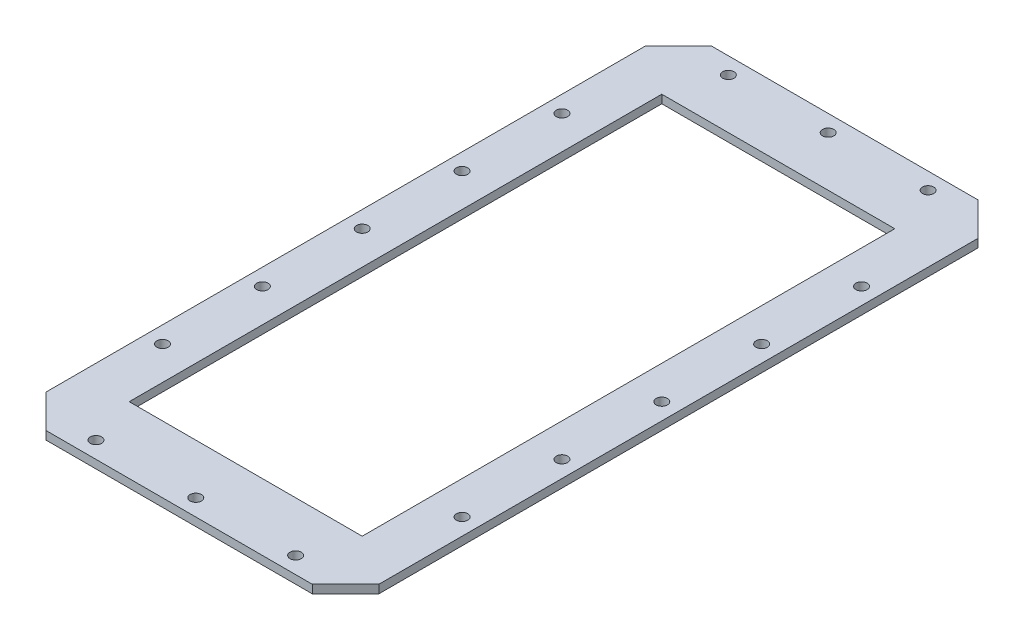
from build123d import *

# Parameters (mm, degrees)
SKETCH2_R           = 2.159
SKETCH2_W           = 88.9
SKETCH2_H           = 203.2
BOSS_EXTRUDE1_DEPTH = 3.175


with BuildPart() as part:
    # Sketch2 → Boss-Extrude1 (new body)
    with BuildSketch(Plane(origin=(0, 0, 0), x_dir=(1, 0, 0), z_dir=(0, 1, 0))):
        Polygon((0, 12.7), (0, 241.3), (12.7, 254), (114.3, 254), (127, 241.3), (127, 12.7), (114.3, 0), (12.7, 0), align=None)
        with Locations(Location((6.35, 165.1, 0), (0, 0, 270))):
            Circle(SKETCH2_R, mode=Mode.SUBTRACT)
        with Locations(Location((25.4, 247.65, 0), (0, 0, 270))):
            Circle(SKETCH2_R, mode=Mode.SUBTRACT)
        with Locations(Location((6.35, 203.2, 0), (0, 0, 270))):
            Circle(SKETCH2_R, mode=Mode.SUBTRACT)
        with Locations(Location((63.5, 247.65, 0), (0, 0, 270))):
            Circle(SKETCH2_R, mode=Mode.SUBTRACT)
        with Locations(Location((6.35, 127, 0), (0, 0, 270))):
            Circle(SKETCH2_R, mode=Mode.SUBTRACT)
        with Locations(Location((120.65, 127, 0), (0, 0, 270))):
            Circle(SKETCH2_R, mode=Mode.SUBTRACT)
        with Locations(Location((120.65, 165.1, 0), (0, 0, 270))):
            Circle(SKETCH2_R, mode=Mode.SUBTRACT)
        with Locations(Location((120.65, 203.2, 0), (0, 0, 270))):
            Circle(SKETCH2_R, mode=Mode.SUBTRACT)
        with Locations(Location((101.6, 247.65, 0), (0, 0, 270))):
            Circle(SKETCH2_R, mode=Mode.SUBTRACT)
        with Locations(Location((101.6, 6.35, 0), (0, 0, 270))):
            Circle(SKETCH2_R, mode=Mode.SUBTRACT)
        with Locations(Location((63.5, 6.35, 0), (0, 0, 270))):
            Circle(SKETCH2_R, mode=Mode.SUBTRACT)
        with Locations(Location((25.4, 6.35, 0), (0, 0, 270))):
            Circle(SKETCH2_R, mode=Mode.SUBTRACT)
        with Locations(Location((120.65, 50.8, 0), (0, 0, 270))):
            Circle(SKETCH2_R, mode=Mode.SUBTRACT)
        with Locations(Location((6.35, 50.8, 0), (0, 0, 270))):
            Circle(SKETCH2_R, mode=Mode.SUBTRACT)
        with Locations(Location((120.65, 88.9, 0), (0, 0, 270))):
            Circle(SKETCH2_R, mode=Mode.SUBTRACT)
        with Locations(Location((6.35, 88.9, 0), (0, 0, 270))):
            Circle(SKETCH2_R, mode=Mode.SUBTRACT)
        with Locations((63.5, 127)):
            Rectangle(SKETCH2_W, SKETCH2_H, mode=Mode.SUBTRACT)
    extrude(amount=BOSS_EXTRUDE1_DEPTH)


solid = part.part
